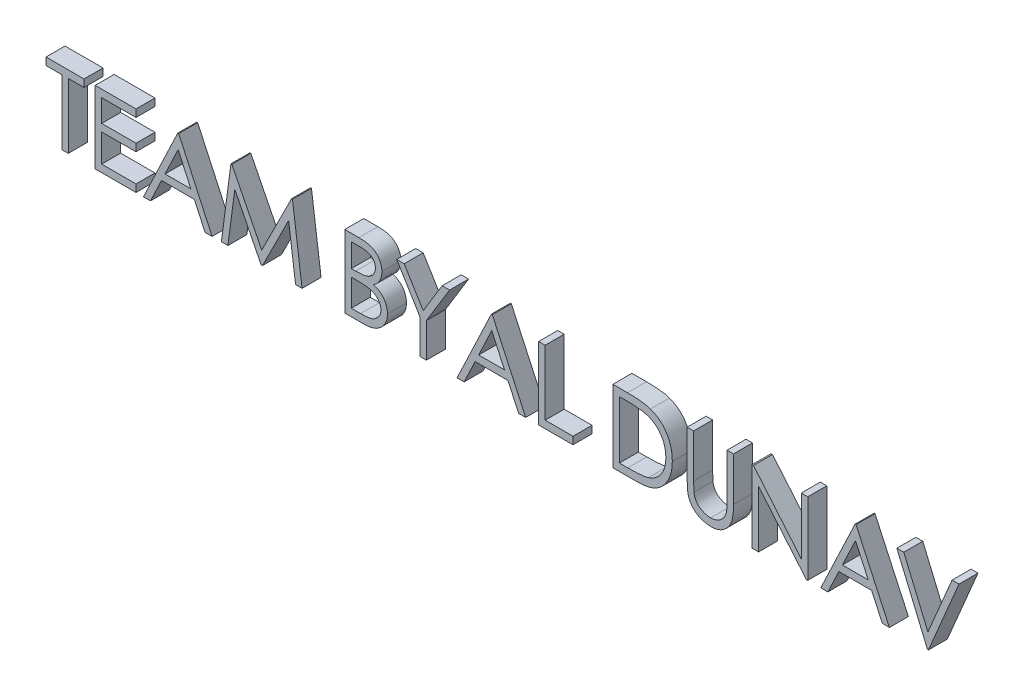
from build123d import *

# Parameters (mm, degrees)
BOSS_EXTRUDE1_DEPTH    = 5
BOSS_EXTRUDE1_2_DEPTH  = 5
BOSS_EXTRUDE1_3_DEPTH  = 5
BOSS_EXTRUDE1_4_DEPTH  = 5
BOSS_EXTRUDE1_5_DEPTH  = 5
BOSS_EXTRUDE1_6_DEPTH  = 5
BOSS_EXTRUDE1_7_DEPTH  = 5
BOSS_EXTRUDE1_8_DEPTH  = 5
BOSS_EXTRUDE1_9_DEPTH  = 5
BOSS_EXTRUDE1_10_DEPTH = 5
BOSS_EXTRUDE1_11_DEPTH = 5
BOSS_EXTRUDE1_12_DEPTH = 5
BOSS_EXTRUDE1_13_DEPTH = 5


with BuildPart() as part:
    # Sketch1 → Boss-Extrude1 (new body)
    with BuildSketch(Plane.XY):
        Polygon((-107.569238462, 17.096153846), (-107.569238462, 19.05), (-97.555776923, 19.05), (-97.555776923, 17.096153846), (-101.7077, 17.096153846), (-101.7077, 0), (-103.417315385, 0), (-103.417315385, 17.096153846), align=None)
    extrude(amount=BOSS_EXTRUDE1_DEPTH)


with BuildPart() as body_2:
    # Sketch1 → Boss-Extrude1 2 (new body)
    with BuildSketch(Plane.XY):
        Polygon((-94.625007693, 19.05), (-83.878853847, 19.05), (-83.878853847, 17.096153846), (-92.915392308, 17.096153846), (-92.915392308, 11.234615385), (-83.878853847, 11.234615385), (-83.878853847, 9.280769231), (-92.915392308, 9.280769231), (-92.915392308, 1.953846154), (-83.878853847, 1.953846154), (-83.878853847, 0), (-94.625007693, 0), align=None)
    extrude(amount=BOSS_EXTRUDE1_2_DEPTH)


with BuildPart() as body_3:
    # Sketch1 → Boss-Extrude1 3 (new body)
    with BuildSketch(Plane.XY):
        Polygon((-72.644238462, 19.05), (-63.85193077, 0), (-65.710374279, 0), (-68.526660337, 6.105769231), (-77.162507693, 6.105769231), (-80.058931972, 0), (-81.925007693, 0), (-72.888469231, 19.05), align=None)
        Polygon((-72.785434375, 15.336929087), (-76.235193991, 8.059615385), (-69.427261298, 8.059615385), align=None, mode=Mode.SUBTRACT)
    extrude(amount=BOSS_EXTRUDE1_3_DEPTH)


with BuildPart() as body_4:
    # Sketch1 → Boss-Extrude1 4 (new body)
    with BuildSketch(Plane.XY):
        Polygon((-61.409623077, 0), (-58.894809375, 19.05), (-58.650578606, 19.05), (-50.785584616, 3.419230769), (-42.939671154, 19.05), (-42.691624279, 19.05), (-40.161546154, 0), (-41.87879375, 0), (-43.702892308, 13.707451923), (-50.579514904, 0), (-50.964941587, 0), (-57.868276923, 13.737980769), (-59.688559375, 0), align=None)
    extrude(amount=BOSS_EXTRUDE1_4_DEPTH)


with BuildPart() as body_5:
    # Sketch1 → Boss-Extrude1 5 (new body)
    with BuildSketch(Plane.XY):
        with BuildLine():
            Line((-28.92693077, 19.05), (-25.21004375, 19.05))
            add(Edge.make_bspline(
                [(-25.21004375, 19.05), (-25.028097319, 19.049043416), (-24.675439853, 19.047189317), (-24.162616891, 19.018433989), (-23.682291222, 18.979225443), (-23.234323546, 18.917013082), (-22.818920866, 18.841946409), (-22.434831298, 18.75104081), (-22.083276217, 18.642038813), (-21.663562609, 18.468704053), (-21.185023012, 18.211130809), (-20.66687176, 17.830519618), (-20.223800115, 17.36497864), (-19.841786017, 16.83983733), (-19.538068494, 16.262155487), (-19.318344176, 15.645701902), (-19.179236311, 14.99842785), (-19.16493012, 14.554055696), (-19.1577, 14.329477163)],
                knots=[0, 0, 0, 0, 1.001505555, 1.941167018, 2.826882275, 3.653841531, 4.429895133, 5.150066043, 5.825578002, 6.45369114, 7.647487171, 8.808567382, 9.977351308, 11.170798116, 12.373658725, 13.556498008, 14.765093433, 16, 16, 16, 16], degree=3))
            add(Edge.make_bspline(
                [(-19.1577, 14.329477163), (-19.163650232, 14.119096825), (-19.175342999, 13.705679619), (-19.287154303, 13.101010253), (-19.462200227, 12.525421476), (-19.705524512, 11.981013921), (-20.021765377, 11.480088113), (-20.396551369, 11.018603136), (-20.848726536, 10.616098097), (-21.1875076, 10.391074585), (-21.359593029, 10.276772837)],
                knots=[0, 0, 0, 0, 1.044552857, 2.05264487, 3.044412934, 4.028983338, 5.005914585, 5.980388656, 6.974128949, 8, 8, 8, 8], degree=3))
            add(Edge.make_bspline(
                [(-21.359593029, 10.276772837), (-21.143182702, 10.193687628), (-20.729136137, 10.034725042), (-20.159345126, 9.753680588), (-19.66842747, 9.447998245), (-19.252608718, 9.114177746), (-18.896985197, 8.754356933), (-18.586454186, 8.363259811), (-18.321488421, 7.935784572), (-18.094450937, 7.476388187), (-17.917292708, 6.989761552), (-17.784618143, 6.480469185), (-17.708595312, 5.95033732), (-17.697776865, 5.589555469), (-17.692315385, 5.407421875)],
                knots=[0, 0, 0, 0, 1.27268992, 2.434971085, 3.483601985, 4.442670788, 5.356604649, 6.2567628, 7.179492994, 8.113709626, 9.066344395, 10.018646069, 10.999752585, 12, 12, 12, 12], degree=3))
            add(Edge.make_bspline(
                [(-17.692315385, 5.407421875), (-17.697632218, 5.221456471), (-17.708093237, 4.855564329), (-17.785272798, 4.318054239), (-17.915950937, 3.804384887), (-18.095952462, 3.311233821), (-18.330878775, 2.839555089), (-18.616780981, 2.388814324), (-18.957675634, 1.963540324), (-19.339017821, 1.559007461), (-19.770430356, 1.195273362), (-20.235880393, 0.871337873), (-20.741229648, 0.604931449), (-21.278178359, 0.381142817), (-21.852749851, 0.210197923), (-22.462364042, 0.090604342), (-23.106495171, 0.010022641), (-23.548508245, 0.003397568), (-23.775187981, 0)],
                knots=[0, 0, 0, 0, 0.978564426, 1.925352924, 2.850884081, 3.763762016, 4.682927383, 5.618979971, 6.567305752, 7.547517671, 8.540179244, 9.531824382, 10.526200242, 11.540722885, 12.589160233, 13.674978461, 14.80764778, 16, 16, 16, 16], degree=3))
            Line((-23.775187981, 0), (-28.92693077, 0))
            Line((-28.92693077, 0), (-28.92693077, 19.05))
        make_face()
        with BuildLine():
            Line((-27.217315385, 17.096153846), (-27.217315385, 10.990384615))
            Line((-27.217315385, 10.990384615), (-26.068667548, 10.990384615))
            add(Edge.make_bspline(
                [(-26.068667548, 10.990384615), (-25.900761962, 10.992561339), (-25.576334153, 10.996767213), (-25.106507287, 11.00881507), (-24.670398259, 11.042550135), (-24.268759854, 11.076275504), (-23.902224552, 11.131110046), (-23.571604391, 11.196381458), (-23.271710599, 11.265412698), (-22.92587393, 11.382812334), (-22.533591168, 11.556317966), (-22.115399558, 11.825586103), (-21.746730516, 12.146302939), (-21.435414395, 12.516368031), (-21.180626248, 12.923853986), (-21.003658741, 13.362259149), (-20.883658523, 13.820657296), (-20.872818902, 14.135353787), (-20.867315385, 14.295132212)],
                knots=[0, 0, 0, 0, 1.156816544, 2.235205308, 3.236616184, 4.169592532, 5.011045266, 5.787822928, 6.49130361, 7.128639758, 8.301311294, 9.436451833, 10.541879658, 11.654887649, 12.756523258, 13.837046038, 14.901820046, 16, 16, 16, 16], degree=3))
            add(Edge.make_bspline(
                [(-20.867315385, 14.295132212), (-20.870179309, 14.400863911), (-20.875797207, 14.608268185), (-20.921807326, 14.910615384), (-21.000007981, 15.194970665), (-21.100452063, 15.465230894), (-21.240816211, 15.712945393), (-21.406080205, 15.946679073), (-21.605755176, 16.158472175), (-21.833034263, 16.356426159), (-22.094338339, 16.531928517), (-22.389511513, 16.685638957), (-22.722547298, 16.809413755), (-23.087832981, 16.917814528), (-23.490991328, 16.993950813), (-23.927369969, 17.057378537), (-24.400543225, 17.089669604), (-24.727904426, 17.093944222), (-24.897123077, 17.096153846)],
                knots=[0, 0, 0, 0, 0.91205012, 1.789085906, 2.630437955, 3.453916878, 4.269457761, 5.079663411, 5.91843418, 6.774407191, 7.675494373, 8.627863946, 9.638891023, 10.736472738, 11.911756761, 13.175263542, 14.539845004, 16, 16, 16, 16], degree=3))
            Line((-24.897123077, 17.096153846), (-27.217315385, 17.096153846))
        make_face(mode=Mode.SUBTRACT)
        with BuildLine():
            Line((-27.217315385, 9.036538462), (-27.217315385, 1.953846154))
            Line((-27.217315385, 1.953846154), (-24.782639904, 1.953846154))
            add(Edge.make_bspline(
                [(-24.782639904, 1.953846154), (-24.608365465, 1.955934836), (-24.272474457, 1.959960496), (-23.78750919, 1.973102571), (-23.338021154, 2.002996243), (-22.926061444, 2.050054368), (-22.547181695, 2.101099927), (-22.205927054, 2.169741327), (-21.899531244, 2.248384955), (-21.544252512, 2.369946664), (-21.144183416, 2.558794599), (-20.713050041, 2.84353346), (-20.329730197, 3.182750321), (-20.004218714, 3.575348582), (-19.737448019, 4.00223909), (-19.543380471, 4.454787352), (-19.42368738, 4.925515723), (-19.409197572, 5.246463115), (-19.40193077, 5.407421875)],
                knots=[0, 0, 0, 0, 1.160039823, 2.235823828, 3.228722157, 4.157150951, 4.99529583, 5.772374946, 6.472645482, 7.099169577, 8.269452708, 9.405989375, 10.527446681, 11.663510218, 12.788923519, 13.866172445, 14.929861265, 16, 16, 16, 16], degree=3))
            add(Edge.make_bspline(
                [(-19.40193077, 5.407421875), (-19.403433566, 5.508078486), (-19.406414919, 5.707768106), (-19.451376266, 6.001224208), (-19.516766043, 6.285482176), (-19.601301419, 6.561313877), (-19.724415947, 6.823732397), (-19.868142999, 7.077927757), (-20.036661485, 7.324235981), (-20.299247588, 7.635634103), (-20.681183675, 7.994410988), (-21.22387341, 8.345679393), (-21.840942632, 8.628968171), (-22.288495129, 8.749252464), (-22.519689183, 8.811388221)],
                knots=[0, 0, 0, 0, 0.723448775, 1.435228256, 2.130040452, 2.821711965, 3.505591119, 4.210454504, 4.921174351, 5.648778258, 7.137944449, 8.670945889, 10.280296675, 12, 12, 12, 12], degree=3))
            add(Edge.make_bspline(
                [(-22.519689183, 8.811388221), (-22.612376119, 8.83019375), (-22.813340515, 8.870968014), (-23.141041774, 8.914008514), (-23.515161289, 8.952353768), (-23.936562949, 8.980717355), (-24.405779913, 9.010035542), (-24.923814285, 9.021437354), (-25.488550526, 9.03504047), (-25.880394724, 9.036026358), (-26.083931972, 9.036538462)],
                knots=[0, 0, 0, 0, 0.634451884, 1.375622551, 2.216452059, 3.157844607, 4.20941857, 5.370758133, 6.634282058, 8, 8, 8, 8], degree=3))
            Line((-26.083931972, 9.036538462), (-27.217315385, 9.036538462))
        make_face(mode=Mode.SUBTRACT)
    extrude(amount=BOSS_EXTRUDE1_5_DEPTH)


with BuildPart() as body_6:
    # Sketch1 → Boss-Extrude1 6 (new body)
    with BuildSketch(Plane.XY):
        Polygon((-15.250007693, 19.05), (-13.292345433, 19.05), (-8.285614664, 10.864453125), (-3.286516106, 19.05), (-1.328853847, 19.05), (-7.434623077, 9.05561899), (-7.434623077, 0), (-9.144238462, 0), (-9.144238462, 9.05561899), align=None)
    extrude(amount=BOSS_EXTRUDE1_6_DEPTH)


with BuildPart() as body_7:
    # Sketch1 → Boss-Extrude1 7 (new body)
    with BuildSketch(Plane.XY):
        Polygon((9.905761538, 19.05), (18.69806923, 0), (16.839625721, 0), (14.023339663, 6.105769231), (5.387492307, 6.105769231), (2.491068028, 0), (0.624992307, 0), (9.661530769, 19.05), align=None)
        Polygon((9.764565625, 15.336929087), (6.314806009, 8.059615385), (13.122738702, 8.059615385), align=None, mode=Mode.SUBTRACT)
    extrude(amount=BOSS_EXTRUDE1_7_DEPTH)


with BuildPart() as body_8:
    # Sketch1 → Boss-Extrude1 8 (new body)
    with BuildSketch(Plane.XY):
        Polygon((22.1173, 19.05), (23.826915384, 19.05), (23.826915384, 1.953846154), (31.153838461, 1.953846154), (31.153838461, 0), (22.1173, 0), align=None)
    extrude(amount=BOSS_EXTRUDE1_8_DEPTH)


with BuildPart() as body_9:
    # Sketch1 → Boss-Extrude1 9 (new body)
    with BuildSketch(Plane.XY):
        with BuildLine():
            Line((41.655761538, 0), (41.655761538, 19.05))
            Line((41.655761538, 19.05), (45.502396153, 19.05))
            add(Edge.make_bspline(
                [(45.502396153, 19.05), (45.836963075, 19.047591155), (46.483344626, 19.042937278), (47.417406662, 19.013429421), (48.281643997, 18.961229885), (49.073214273, 18.88519575), (49.794290584, 18.791834239), (50.442853865, 18.674810609), (51.022257672, 18.536626425), (51.378598484, 18.418813331), (51.547107692, 18.363100962)],
                knots=[0, 0, 0, 0, 1.314313732, 2.53924729, 3.670748893, 4.714932338, 5.66265055, 6.526160246, 7.303039223, 8, 8, 8, 8], degree=3))
            add(Edge.make_bspline(
                [(51.547107692, 18.363100962), (51.767514773, 18.279113835), (52.203330834, 18.113044132), (52.823855315, 17.799773406), (53.408011934, 17.444827809), (53.958933279, 17.047739471), (54.46403492, 16.597264945), (54.94304933, 16.112539951), (55.376380898, 15.575937699), (55.773210338, 14.998586693), (56.131000141, 14.387288237), (56.442000415, 13.743207146), (56.700285721, 13.069614342), (56.914697426, 12.368383036), (57.083678859, 11.637971323), (57.198969087, 10.877528709), (57.275011189, 10.09006055), (57.28265324, 9.555710968), (57.286530769, 9.284585337)],
                knots=[0, 0, 0, 0, 0.984719456, 1.947108742, 2.898477687, 3.838006223, 4.779231079, 5.722358779, 6.681677486, 7.655904652, 8.64651281, 9.637519902, 10.640069247, 11.656948941, 12.698408672, 13.768548281, 14.867775369, 16, 16, 16, 16], degree=3))
            add(Edge.make_bspline(
                [(57.286530769, 9.284585337), (57.283107389, 9.049120596), (57.276361261, 8.58511273), (57.215785984, 7.901267284), (57.127740585, 7.237709131), (56.991428594, 6.597598107), (56.825952057, 5.97532595), (56.613875747, 5.377524734), (56.370931118, 4.798710572), (56.087631065, 4.246709738), (55.776618669, 3.723741669), (55.442853181, 3.230752009), (55.086690596, 2.774775444), (54.704734652, 2.354431142), (54.301921224, 1.970352779), (53.875613081, 1.619331953), (53.424710191, 1.30823699), (52.951232114, 1.024843158), (52.441366325, 0.777626652), (51.885455396, 0.568457598), (51.281128556, 0.395121021), (50.629869162, 0.250499431), (49.930551947, 0.135778683), (49.182491291, 0.058890747), (48.386836528, 0.006895499), (47.840486527, 0.00234313), (47.559277163, 0)],
                knots=[0, 0, 0, 0, 1.105936401, 2.179363191, 3.223086493, 4.248585256, 5.251745608, 6.245858792, 7.225916811, 8.198733463, 9.158002045, 10.082870192, 10.993790845, 11.873723703, 12.748670949, 13.606408763, 14.465103618, 15.319838547, 16.196477973, 17.123216899, 18.106603292, 19.147568657, 20.255746949, 21.433717677, 22.679120308, 24, 24, 24, 24], degree=3))
            Line((47.559277163, 0), (41.655761538, 0))
        make_face()
        with BuildLine():
            Line((43.365376923, 1.953846154), (45.552005528, 1.953846154))
            add(Edge.make_bspline(
                [(45.552005528, 1.953846154), (45.866212803, 1.955196507), (46.470548463, 1.957793731), (47.339544134, 1.980584079), (48.133544849, 2.017823767), (48.852663351, 2.069939548), (49.496493611, 2.138893011), (50.066381164, 2.215772839), (50.560457927, 2.311553249), (50.859431006, 2.398372042), (50.997588461, 2.438491587)],
                knots=[0, 0, 0, 0, 1.375205317, 2.645023457, 3.804390687, 4.853969522, 5.800190428, 6.637939096, 7.370582563, 8, 8, 8, 8], degree=3))
            add(Edge.make_bspline(
                [(50.997588461, 2.438491587), (51.171478832, 2.499732211), (51.515106205, 2.620750728), (52.009758969, 2.841500284), (52.471079237, 3.102986406), (52.907106661, 3.393647355), (53.311656028, 3.72373488), (53.689521575, 4.086071262), (54.039942523, 4.482500538), (54.359298399, 4.912530674), (54.645093597, 5.373485133), (54.892587003, 5.860832214), (55.109493196, 6.369232138), (55.279738107, 6.906491987), (55.41317293, 7.467808719), (55.507686446, 8.053221823), (55.566549446, 8.662621971), (55.573415327, 9.077107105), (55.576915384, 9.288401442)],
                knots=[0, 0, 0, 0, 0.998632004, 1.973411704, 2.929992603, 3.868527914, 4.809262121, 5.754881198, 6.702106254, 7.672490631, 8.653608572, 9.636854334, 10.631411391, 11.644891563, 12.686317036, 13.754757253, 14.855430412, 16, 16, 16, 16], degree=3))
            add(Edge.make_bspline(
                [(55.576915384, 9.288401442), (55.574121634, 9.511196528), (55.568633288, 9.948879446), (55.499648827, 10.591085944), (55.398838647, 11.208744914), (55.25305887, 11.801897663), (55.067289372, 12.371701408), (54.835452822, 12.915004742), (54.570567366, 13.437545529), (54.255407775, 13.927263148), (53.91024576, 14.390412785), (53.527189016, 14.814710254), (53.11232335, 15.201122088), (52.670173669, 15.555666061), (52.188278886, 15.864078354), (51.67799094, 16.139958718), (51.131823787, 16.37408807), (50.751843257, 16.498614451), (50.558736298, 16.561899038)],
                knots=[0, 0, 0, 0, 1.122418816, 2.205001699, 3.251619955, 4.274784885, 5.280384055, 6.268708349, 7.249350384, 8.229342522, 9.199999885, 10.157847722, 11.105861043, 12.055065948, 13.010012805, 13.98527497, 14.976112212, 16, 16, 16, 16], degree=3))
            add(Edge.make_bspline(
                [(50.558736298, 16.561899038), (50.398982201, 16.606075596), (50.05930116, 16.700007078), (49.505003505, 16.802470891), (48.881169621, 16.892846807), (48.185029819, 16.969362707), (47.417377634, 17.024266556), (46.577622675, 17.06547614), (45.665401971, 17.093270811), (45.033037036, 17.095168774), (44.704830048, 17.096153846)],
                knots=[0, 0, 0, 0, 0.674548936, 1.434276114, 2.292660221, 3.240891867, 4.284742987, 5.42552168, 6.663806718, 8, 8, 8, 8], degree=3))
            Line((44.704830048, 17.096153846), (43.365376923, 17.096153846))
            Line((43.365376923, 17.096153846), (43.365376923, 1.953846154))
        make_face(mode=Mode.SUBTRACT)
    extrude(amount=BOSS_EXTRUDE1_9_DEPTH)


with BuildPart() as body_10:
    # Sketch1 → Boss-Extrude1 10 (new body)
    with BuildSketch(Plane.XY):
        with BuildLine():
            Line((61.194223077, 19.05), (62.903838461, 19.05))
            Line((62.903838461, 19.05), (62.903838461, 7.636027644))
            add(Edge.make_bspline(
                [(62.903838461, 7.636027644), (62.90358404, 7.47447964), (62.903101233, 7.167914462), (62.906326201, 6.731569854), (62.915357907, 6.343644041), (62.921052004, 6.002641707), (62.933719348, 5.71012761), (62.944050146, 5.46451699), (62.957333747, 5.266972831), (62.973298287, 5.151688077), (62.980160577, 5.102133413)],
                knots=[0, 0, 0, 0, 1.528628734, 2.90083645, 4.128790002, 5.200304208, 6.127813768, 6.898992206, 7.526736466, 8, 8, 8, 8], degree=3))
            add(Edge.make_bspline(
                [(62.980160577, 5.102133413), (63.008340745, 4.923353173), (63.063113231, 4.575866319), (63.202702801, 4.081065527), (63.397652342, 3.635124305), (63.628663761, 3.224127134), (63.933096974, 2.859513618), (64.297787644, 2.523625907), (64.739626642, 2.229865085), (65.230902224, 1.961255666), (65.760411874, 1.745364289), (66.301493195, 1.582114692), (66.846012839, 1.482625252), (67.210554537, 1.471105233), (67.391578846, 1.465384615)],
                knots=[0, 0, 0, 0, 1.035780045, 2.013197591, 2.933192213, 3.817615948, 4.702609284, 5.640816605, 6.646850145, 7.73207398, 8.84249596, 9.914020372, 10.964143139, 12, 12, 12, 12], degree=3))
            add(Edge.make_bspline(
                [(67.391578846, 1.465384615), (67.546992776, 1.471229429), (67.856923005, 1.482885298), (68.317423721, 1.555065373), (68.765915741, 1.685152738), (69.204613727, 1.853009137), (69.615826942, 2.074792454), (69.99978482, 2.330992309), (70.342488519, 2.63149722), (70.655224193, 2.964057667), (70.927557201, 3.339287149), (71.163620129, 3.749015301), (71.356982689, 4.199408174), (71.452469588, 4.515934387), (71.501524759, 4.678545673)],
                knots=[0, 0, 0, 0, 0.994687771, 1.983630487, 2.973142513, 3.978332533, 4.983357753, 5.956394766, 6.925816176, 7.893390482, 8.871859704, 9.88551698, 10.913711441, 12, 12, 12, 12], degree=3))
            add(Edge.make_bspline(
                [(71.501524759, 4.678545673), (71.517854013, 4.745757199), (71.55424217, 4.895531565), (71.588243943, 5.148740304), (71.623658032, 5.447495271), (71.648230191, 5.793942995), (71.672185405, 6.186922574), (71.686516844, 6.628481204), (71.693140981, 7.117015519), (71.695114998, 7.457940643), (71.696146153, 7.636027644)],
                knots=[0, 0, 0, 0, 0.558680831, 1.244966039, 2.062412453, 2.990489873, 4.051219941, 5.244515665, 6.560634259, 8, 8, 8, 8], degree=3))
            Line((71.696146153, 7.636027644), (71.696146153, 19.05))
            Line((71.696146153, 19.05), (73.405761538, 19.05))
            Line((73.405761538, 19.05), (73.405761538, 7.544441106))
            add(Edge.make_bspline(
                [(73.405761538, 7.544441106), (73.404378397, 7.337077072), (73.401679113, 6.932393552), (73.37827169, 6.339386869), (73.340950019, 5.776851356), (73.28821914, 5.244711397), (73.218349166, 4.744871187), (73.14065118, 4.27294952), (73.041702579, 3.832333946), (72.92613221, 3.41958893), (72.794014755, 3.026693493), (72.622885076, 2.65381089), (72.430074584, 2.289605372), (72.20139483, 1.939585522), (71.944430019, 1.602201569), (71.653500157, 1.279499603), (71.338227224, 0.966322794), (70.993370192, 0.670704534), (70.624613762, 0.399603022), (70.233054849, 0.16121801), (69.821701288, -0.04029625), (69.391622359, -0.206172353), (68.942634526, -0.330893243), (68.474726468, -0.423830877), (67.986833145, -0.476639096), (67.65501123, -0.484487316), (67.48698149, -0.488461538)],
                knots=[0, 0, 0, 0, 1.316592851, 2.569410997, 3.76748051, 4.895814652, 5.963796859, 6.97159953, 7.931736103, 8.829262218, 9.692595152, 10.560224239, 11.431080259, 12.30701507, 13.211635791, 14.121146779, 15.063487852, 16.031507147, 17.00238618, 17.966455255, 18.938106653, 19.907068911, 20.888905087, 21.893141452, 22.933117798, 24, 24, 24, 24], degree=3))
            add(Edge.make_bspline(
                [(67.48698149, -0.488461538), (67.303725374, -0.484190173), (66.944177531, -0.47580977), (66.414380336, -0.427788801), (65.906484496, -0.337337255), (65.415125794, -0.222166704), (64.946993831, -0.063323791), (64.495816655, 0.122267431), (64.069321548, 0.350199376), (63.660589491, 0.603800558), (63.280543318, 0.889140375), (62.93167031, 1.200146179), (62.6133945, 1.531835947), (62.331080596, 1.887800795), (62.08005121, 2.265272229), (61.863805334, 2.665318091), (61.678131819, 3.087783498), (61.58230179, 3.38144306), (61.53385649, 3.529897837)],
                knots=[0, 0, 0, 0, 1.13879206, 2.234305948, 3.301075583, 4.341971843, 5.366689343, 6.369221514, 7.369726634, 8.367512178, 9.355451585, 10.318319045, 11.268648973, 12.207971039, 13.137398894, 14.081662264, 15.030215811, 16, 16, 16, 16], degree=3))
            add(Edge.make_bspline(
                [(61.53385649, 3.529897837), (61.505677958, 3.631312277), (61.444558093, 3.851282458), (61.379106116, 4.21533606), (61.324083829, 4.634517255), (61.272346434, 5.108854735), (61.241817677, 5.638716152), (61.21505276, 6.223871822), (61.194034521, 6.8650293), (61.194158468, 7.311640306), (61.194223077, 7.544441106)],
                knots=[0, 0, 0, 0, 0.625038921, 1.35572334, 2.194682327, 3.136881307, 4.189498639, 5.346923369, 6.617055217, 8, 8, 8, 8], degree=3))
            Line((61.194223077, 7.544441106), (61.194223077, 19.05))
        make_face()
    extrude(amount=BOSS_EXTRUDE1_10_DEPTH)


with BuildPart() as body_11:
    # Sketch1 → Boss-Extrude1 11 (new body)
    with BuildSketch(Plane.XY):
        Polygon((78.290376923, 0), (78.290376923, 19.05), (78.649090865, 19.05), (91.234607692, 4.056520433), (91.234607692, 19.05), (92.944223077, 19.05), (92.944223077, 0), (92.554980288, 0), (79.999992307, 14.959134615), (79.999992307, 0), align=None)
    extrude(amount=BOSS_EXTRUDE1_11_DEPTH)


with BuildPart() as body_12:
    # Sketch1 → Boss-Extrude1 12 (new body)
    with BuildSketch(Plane.XY):
        Polygon((105.644223077, 19.05), (114.436530769, 0), (112.578087259, 0), (109.761801202, 6.105769231), (101.125953846, 6.105769231), (98.229529567, 0), (96.363453846, 0), (105.399992307, 19.05), align=None)
        Polygon((105.503027163, 15.336929087), (102.053267548, 8.059615385), (108.86120024, 8.059615385), align=None, mode=Mode.SUBTRACT)
    extrude(amount=BOSS_EXTRUDE1_12_DEPTH)


with BuildPart() as body_13:
    # Sketch1 → Boss-Extrude1 13 (new body)
    with BuildSketch(Plane.XY):
        Polygon((116.390376923, 19.05), (118.222107692, 19.05), (124.572107692, 4.037439904), (130.922107692, 19.05), (132.753838461, 19.05), (124.694223077, 0), (124.449992307, 0), align=None)
    extrude(amount=BOSS_EXTRUDE1_13_DEPTH)


solid = Compound([part.part, body_2.part, body_3.part, body_4.part, body_5.part, body_6.part, body_7.part, body_8.part, body_9.part, body_10.part, body_11.part, body_12.part, body_13.part])
